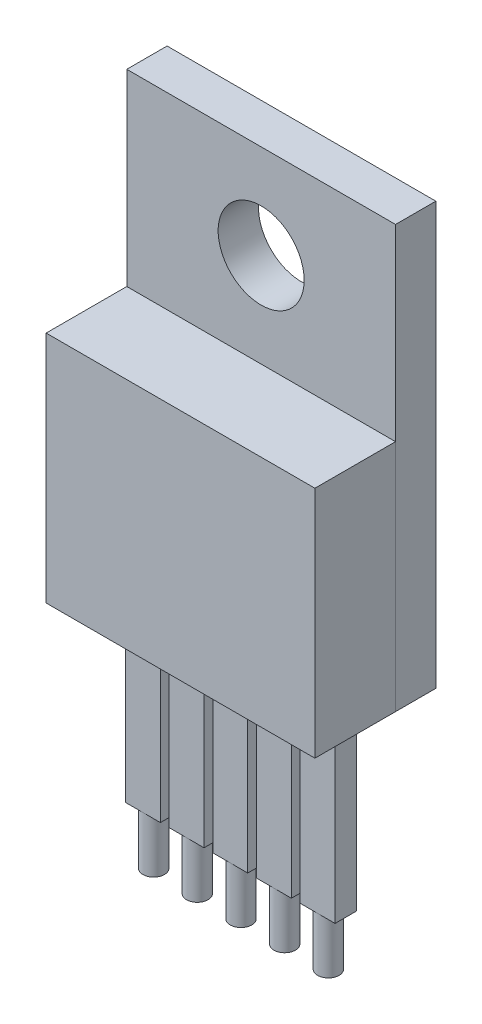
from build123d import *

# Parameters (mm, degrees)
SKETCH1_W           = 10
SKETCH1_H           = 15.7
SKETCH1_R           = 1.6
BOSS_EXTRUDE1_DEPTH = 1.5
SKETCH2_W           = 10
SKETCH2_H           = 8.7
BOSS_EXTRUDE2_DEPTH = 3
SKETCH4_W           = 1.3
SKETCH4_H           = 0.8
BOSS_EXTRUDE3_DEPTH = 6.8
SKETCH5_R           = 0.4
BOSS_EXTRUDE4_DEPTH = 2


with BuildPart() as part:
    # Sketch1 → Boss-Extrude1 (new body)
    with BuildSketch(Plane.XY):
        with Locations((0, -4.35)):
            Rectangle(SKETCH1_W, SKETCH1_H)
        Circle(SKETCH1_R, mode=Mode.SUBTRACT)
    extrude(amount=BOSS_EXTRUDE1_DEPTH)

    # Sketch2 → Boss-Extrude2 (add)
    with BuildSketch(Plane.XY.offset(1.5)):
        with Locations((0, -7.85)):
            Rectangle(SKETCH2_W, SKETCH2_H)
    extrude(amount=BOSS_EXTRUDE2_DEPTH)

    # Sketch4 → Boss-Extrude3 (add)
    with BuildSketch(Plane.XZ.offset(12.2)):
        with Locations((-3.25, 2.25)):
            Rectangle(SKETCH4_W, SKETCH4_H)
        with Locations((-1.625, 2.25)):
            Rectangle(SKETCH4_W, SKETCH4_H)
        with Locations((0, 2.25)):
            Rectangle(SKETCH4_W, SKETCH4_H)
        with Locations((1.625, 2.25)):
            Rectangle(SKETCH4_W, SKETCH4_H)
        with Locations((3.25, 2.25)):
            Rectangle(SKETCH4_W, SKETCH4_H)
    extrude(amount=BOSS_EXTRUDE3_DEPTH)

    # Sketch5 → Boss-Extrude4 (add)
    with BuildSketch(Plane.XZ.offset(19)):
        with Locations(Location((-3.25, 2.25, 0), (0, 0, 270))):
            Circle(SKETCH5_R)
        with Locations(Location((-1.625, 2.25, 0), (0, 0, 270))):
            Circle(SKETCH5_R)
        with Locations(Location((0, 2.25, 0), (0, 0, 270))):
            Circle(SKETCH5_R)
        with Locations(Location((1.625, 2.25, 0), (0, 0, 270))):
            Circle(SKETCH5_R)
        with Locations(Location((3.25, 2.25, 0), (0, 0, 270))):
            Circle(SKETCH5_R)
    extrude(amount=BOSS_EXTRUDE4_DEPTH)


solid = part.part
